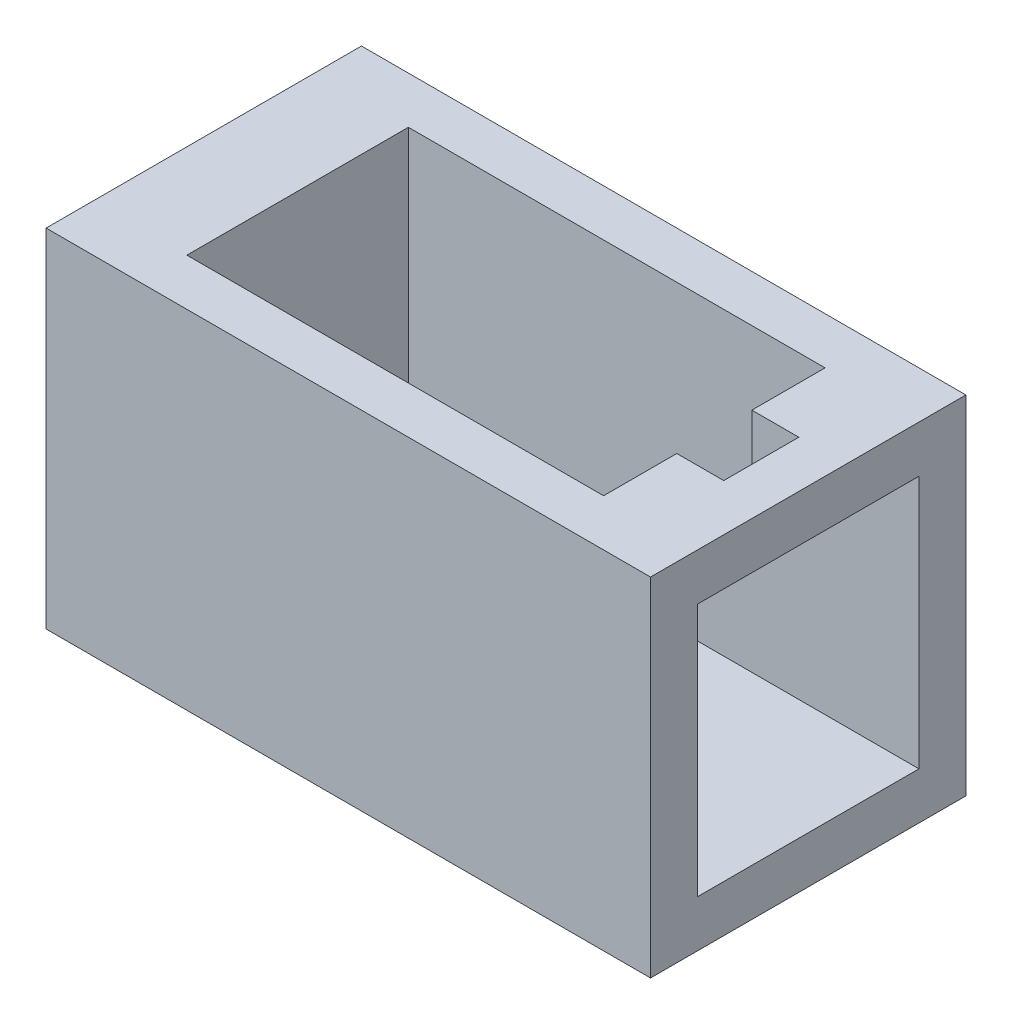
from build123d import *

# Parameters (mm, degrees)
SKETCH2_W           = 32.2
SKETCH2_H           = 16.8
BOSS_EXTRUDE1_DEPTH = 18.5
SKETCH3_W           = 22.2
SKETCH3_H           = 11.8
CUT_EXTRUDE1_DEPTH  = 16
SKETCH4_W           = 11.8
SKETCH4_H           = 13.5
CUT_EXTRUDE2_DEPTH  = 5
SKETCH5_W           = 2.5
SKETCH5_H           = 4
CUT_EXTRUDE3_DEPTH  = 2.5


with BuildPart() as part:
    # Sketch2 → Boss-Extrude1 (new body)
    with BuildSketch(Plane(origin=(0, 0, 0), x_dir=(1, 0, 0), z_dir=(0, 1, 0))):
        Rectangle(SKETCH2_W, SKETCH2_H)
    extrude(amount=-BOSS_EXTRUDE1_DEPTH)

    # Sketch3 → Cut-Extrude1 (cut)
    with BuildSketch(Plane(origin=(0, 0, 0), x_dir=(1, 0, 0), z_dir=(0, 1, 0))):
        Rectangle(SKETCH3_W, SKETCH3_H)
    extrude(amount=-CUT_EXTRUDE1_DEPTH, mode=Mode.SUBTRACT)

    # Sketch4 → Cut-Extrude2 (cut)
    with BuildSketch(Plane(origin=(16.1, 0, 0), x_dir=(0, 0, -1), z_dir=(1, 0, 0))):
        with Locations((0, -9.25)):
            Rectangle(SKETCH4_W, SKETCH4_H)
    extrude(amount=-CUT_EXTRUDE2_DEPTH, mode=Mode.SUBTRACT)

    # Sketch5 → Cut-Extrude3 (cut)
    with BuildSketch(Plane(origin=(0, 0, 0), x_dir=(1, 0, 0), z_dir=(0, 1, 0))):
        with Locations((12.35, 0)):
            Rectangle(SKETCH5_W, SKETCH5_H)
    extrude(amount=-CUT_EXTRUDE3_DEPTH, mode=Mode.SUBTRACT)


solid = part.part
